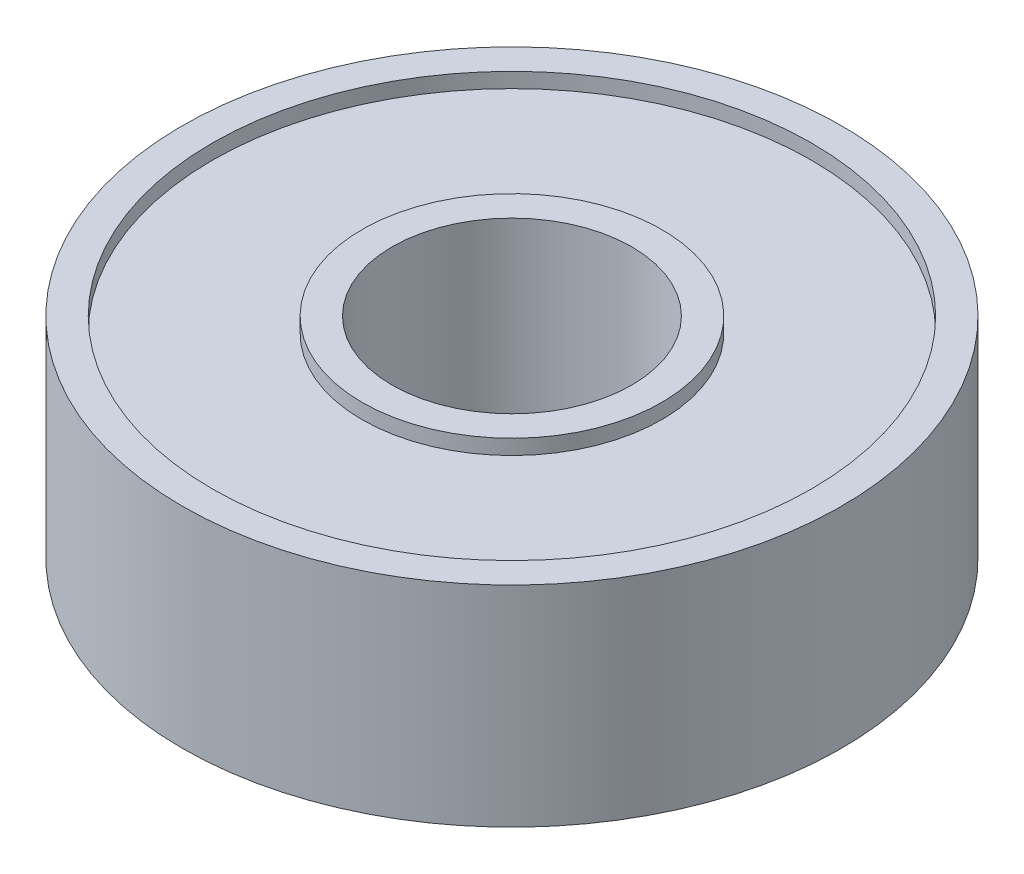
from build123d import *

# Parameters (mm, degrees)
SKETCH2_R           = 11
SKETCH2_R_2         = 4
BOSS_EXTRUDE1_DEPTH = 7
SKETCH3_R           = 10
SKETCH3_R_2         = 5
CUT_EXTRUDE1_DEPTH  = 0.5


with BuildPart() as part:
    # Sketch2 → Boss-Extrude1 (new body)
    with BuildSketch(Plane(origin=(0, 0, 0), x_dir=(1, 0, 0), z_dir=(0, 1, 0))):
        with Locations(Location((0, 0, 0), (0, 0, 270))):
            Circle(SKETCH2_R)
        with Locations(Location((0, 0, 0), (0, 0, 270))):
            Circle(SKETCH2_R_2, mode=Mode.SUBTRACT)
    extrude(amount=BOSS_EXTRUDE1_DEPTH)

    # Sketch3 → Cut-Extrude1 (cut)
    with BuildSketch(Plane(origin=(0, 7, 0), x_dir=(1, 0, 0), z_dir=(0, 1, 0))):
        with Locations(Location((0, 0, 0), (0, 0, 270))):
            Circle(SKETCH3_R)
        with Locations(Location((0, 0, 0), (0, 0, 270))):
            Circle(SKETCH3_R_2, mode=Mode.SUBTRACT)
    cut_extrude1 = extrude(amount=-CUT_EXTRUDE1_DEPTH, mode=Mode.SUBTRACT)

    # Mirror1: Cut-Extrude1 across plane
    add(cut_extrude1.mirror(Plane.ZX.offset(3.5)), mode=Mode.SUBTRACT)


solid = part.part
